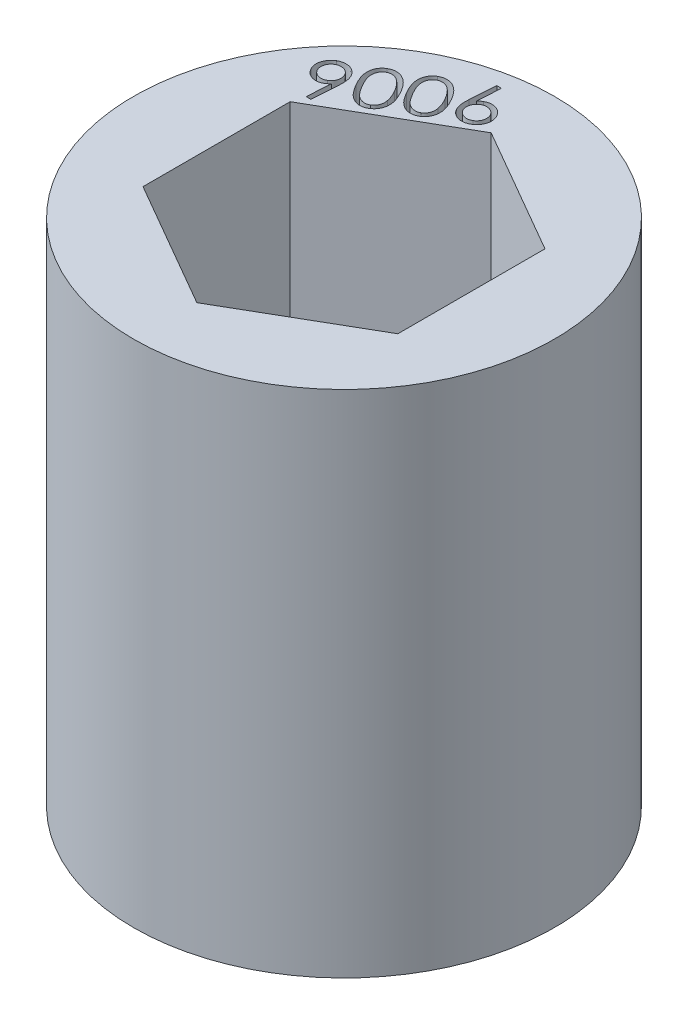
from build123d import *

# Parameters (mm, degrees)
SKETCH1_R           = 11.1125
BOSS_EXTRUDE1_DEPTH = 26.924
CUT_EXTRUDE1_DEPTH  = 2


with BuildPart() as part:
    # Sketch1 → Boss-Extrude1 (new body)
    with BuildSketch(Plane(origin=(0, 0, 0), x_dir=(1, 0, 0), z_dir=(0, 1, 0))):
        with Locations(Location((0, 0, 0), (0, 0, 270))):
            Circle(SKETCH1_R)
        Polygon((0, 7.772289324), (-6.731, 3.886144662), (-6.731, -3.886144662), (0, -7.772289324), (6.731, -3.886144662), (6.731, 3.886144662), align=None, mode=Mode.SUBTRACT)
    extrude(amount=BOSS_EXTRUDE1_DEPTH)

    # Sketch2 → Cut-Extrude1 (cut)
    # profile 1 of 4: a face of its own
    with BuildSketch(Plane(origin=(0, 26.924, 0), x_dir=(1, 0, 0), z_dir=(0, 1, 0))):
        with BuildLine():
            Line((-6.289733288, 4.536079133), (-6.537525756, 4.548290671))
            Line((-6.537525756, 4.548290671), (-6.464256525, 5.791323524))
            add(Edge.make_bspline(
                [(-6.464256525, 5.791323524), (-6.480242541, 5.773894572), (-6.511338885, 5.739991398), (-6.561839603, 5.69527463), (-6.612409982, 5.655457776), (-6.648221968, 5.633601591), (-6.66574691, 5.622906056)],
                knots=[0, 0, 0, 0, 1.07557127, 2.092224476, 3.066411598, 4, 4, 4, 4], degree=3))
            add(Edge.make_bspline(
                [(-6.66574691, 5.622906056), (-6.687405443, 5.611087473), (-6.730257805, 5.587703887), (-6.797554319, 5.560988642), (-6.865684027, 5.541202356), (-6.93486375, 5.529817864), (-7.004705016, 5.524358865), (-7.075685789, 5.527087617), (-7.147393014, 5.537446994), (-7.219246238, 5.554721004), (-7.289510388, 5.578337576), (-7.35650875, 5.608467922), (-7.419450569, 5.644728708), (-7.478082535, 5.687225822), (-7.532917297, 5.735292443), (-7.583437177, 5.789428113), (-7.629542025, 5.849943619), (-7.656438539, 5.893688865), (-7.670145948, 5.915982979)],
                knots=[0, 0, 0, 0, 1.015135184, 2.008489705, 2.974464217, 3.930823522, 4.890110555, 5.854468119, 6.84900024, 7.868689235, 8.893387844, 9.896732215, 10.888539014, 11.878968029, 12.873598221, 13.886496971, 14.922884625, 16, 16, 16, 16], degree=3))
            add(Edge.make_bspline(
                [(-7.670145948, 5.915982979), (-7.686989422, 5.947462864), (-7.72012857, 6.009398813), (-7.753683399, 6.108003656), (-7.77554064, 6.207694842), (-7.781550764, 6.308794459), (-7.775514984, 6.409686012), (-7.754046851, 6.508718862), (-7.719584706, 6.605382614), (-7.671907384, 6.698347933), (-7.612573873, 6.785344663), (-7.543839337, 6.864438697), (-7.464533964, 6.933174876), (-7.405410215, 6.970311538), (-7.375542583, 6.989071921)],
                knots=[0, 0, 0, 0, 1.035324533, 2.036977218, 3.013660684, 3.991039457, 4.968418229, 5.940283026, 6.923354643, 7.941094773, 8.965736768, 9.974485588, 10.976767849, 12, 12, 12, 12], degree=3))
            add(Edge.make_bspline(
                [(-7.375542583, 6.989071921), (-7.34507095, 7.005375839), (-7.284810938, 7.037618098), (-7.188138027, 7.070437121), (-7.088780159, 7.090561187), (-6.987526986, 7.097552892), (-6.886165863, 7.091769651), (-6.78725838, 7.071601586), (-6.691339738, 7.038343454), (-6.60068211, 6.990771666), (-6.515764574, 6.933108074), (-6.439404084, 6.865662075), (-6.372846225, 6.788703753), (-6.336853355, 6.731436227), (-6.318735692, 6.702609581)],
                knots=[0, 0, 0, 0, 1.019400264, 2.015942902, 3.002372847, 4.006779929, 5.005536382, 5.991966327, 6.979044859, 7.994053264, 9.007032045, 10.004279611, 10.995418019, 12, 12, 12, 12], degree=3))
            add(Edge.make_bspline(
                [(-6.318735692, 6.702609581), (-6.306240701, 6.679251996), (-6.280812696, 6.631718005), (-6.25054166, 6.554911705), (-6.226293373, 6.472609431), (-6.210571268, 6.400087646), (-6.201314114, 6.338420317), (-6.195489764, 6.288208021), (-6.192449763, 6.234523461), (-6.189498973, 6.177377331), (-6.1893075, 6.116958119), (-6.190314512, 6.053006011), (-6.19282965, 5.985653618), (-6.195674596, 5.939552777), (-6.197129121, 5.915982979)],
                knots=[0, 0, 0, 0, 1.179517641, 2.400384276, 3.669978525, 4.99951221, 5.702757638, 6.447991837, 7.250775919, 8.098000084, 8.997311831, 9.942054579, 10.947842213, 12, 12, 12, 12], degree=3))
            Line((-6.197129121, 5.915982979), (-6.289733288, 4.536079133))
        make_face()
        with BuildLine():
            add(Edge.make_bspline(
                [(-6.726295788, 5.844749004), (-6.71064732, 5.854271721), (-6.67991488, 5.872973636), (-6.638085098, 5.906050151), (-6.59996958, 5.941564352), (-6.566919829, 5.981135696), (-6.537714626, 6.023521997), (-6.512770228, 6.069073108), (-6.491586076, 6.117668987), (-6.475865153, 6.169141379), (-6.463817651, 6.221644628), (-6.458056762, 6.274374402), (-6.456118693, 6.326312762), (-6.460240047, 6.377704907), (-6.470203983, 6.428038328), (-6.484352589, 6.47793469), (-6.504337626, 6.526979386), (-6.521287063, 6.558422458), (-6.529893544, 6.574388428)],
                knots=[0, 0, 0, 0, 1.045108442, 2.052516081, 3.039037663, 4.014948609, 4.990090363, 5.974041511, 6.976128051, 8.011453109, 9.043011603, 10.047295345, 11.035574291, 12.007150616, 12.98344593, 13.961229243, 14.964765542, 16, 16, 16, 16], degree=3))
            add(Edge.make_bspline(
                [(-6.529893544, 6.574388428), (-6.539249183, 6.589862662), (-6.557739817, 6.620446186), (-6.590521987, 6.662080801), (-6.626381741, 6.699690397), (-6.665743743, 6.732780086), (-6.708181599, 6.761903737), (-6.753581699, 6.787026304), (-6.802439709, 6.807412214), (-6.853751361, 6.823401486), (-6.906330508, 6.835095), (-6.95895449, 6.841964713), (-7.010975356, 6.842867475), (-7.062261796, 6.838767193), (-7.11298991, 6.829718382), (-7.162946419, 6.81457088), (-7.212656065, 6.795071434), (-7.244107621, 6.777604573), (-7.260041781, 6.768755415)],
                knots=[0, 0, 0, 0, 1.031712043, 2.039092063, 3.018573684, 3.994457873, 4.969572892, 5.953497063, 6.951758218, 7.98705489, 9.018585102, 10.024008046, 11.012022604, 11.983572292, 12.958061913, 13.947831088, 14.960318852, 16, 16, 16, 16], degree=3))
            add(Edge.make_bspline(
                [(-7.260041781, 6.768755415), (-7.275548329, 6.759439004), (-7.306081237, 6.741094681), (-7.34725729, 6.707776179), (-7.385379905, 6.672479408), (-7.418356414, 6.632849856), (-7.447704876, 6.590638681), (-7.471928382, 6.544786242), (-7.493265763, 6.496366511), (-7.508934864, 6.444865827), (-7.520996677, 6.392370164), (-7.526733977, 6.339807253), (-7.528690189, 6.288040119), (-7.524568034, 6.236817067), (-7.514607962, 6.186483739), (-7.500458314, 6.136587351), (-7.48047356, 6.087542663), (-7.463524083, 6.05609959), (-7.454917583, 6.04013362)],
                knots=[0, 0, 0, 0, 1.034021631, 2.036022986, 3.024725885, 4.002794686, 4.980092595, 5.961574923, 6.965877195, 8.00349148, 9.037330872, 10.043835206, 11.024597356, 11.998321951, 12.97677597, 13.956721278, 14.962476515, 16, 16, 16, 16], degree=3))
            add(Edge.make_bspline(
                [(-7.454917583, 6.04013362), (-7.445562349, 6.024658768), (-7.427072518, 5.994074025), (-7.394284497, 5.95244831), (-7.358446249, 5.914806002), (-7.319111883, 5.881927029), (-7.277096804, 5.852416955), (-7.231595382, 5.827649353), (-7.183019633, 5.806434909), (-7.131541644, 5.790722408), (-7.079039897, 5.778672645), (-7.026309733, 5.772912344), (-6.974371474, 5.770974121), (-6.922979303, 5.775095516), (-6.872645889, 5.785059441), (-6.822749524, 5.79920805), (-6.77370483, 5.819193086), (-6.742261757, 5.836142524), (-6.726295788, 5.844749004)],
                knots=[0, 0, 0, 0, 1.033571637, 2.042767394, 3.024014467, 4.001657624, 4.970548117, 5.956245748, 6.96011096, 7.997273687, 9.030663166, 10.03672948, 11.026762591, 12.000063433, 12.97809164, 13.957610489, 14.962928033, 16, 16, 16, 16], degree=3))
        make_face(mode=Mode.SUBTRACT)
    # profile 2 of 4: a face of its own
    with BuildSketch(Plane(origin=(0, 26.924, 0), x_dir=(1, 0, 0), z_dir=(0, 1, 0))):
        with BuildLine():
            add(Edge.make_bspline(
                [(-5.754187339, 6.384091953), (-5.774293485, 6.419396325), (-5.813397002, 6.488058169), (-5.866034024, 6.590465673), (-5.91315215, 6.687996963), (-5.953449969, 6.781164397), (-5.987295398, 6.86972097), (-6.014264868, 6.953849745), (-6.035638255, 7.033380296), (-6.049888486, 7.109113956), (-6.058619809, 7.181548399), (-6.062601698, 7.251221126), (-6.062856211, 7.318691765), (-6.058271229, 7.383994619), (-6.049205939, 7.447116612), (-6.035432829, 7.50803618), (-6.016976099, 7.566647617), (-5.994620362, 7.623140357), (-5.968452651, 7.677139167), (-5.937349294, 7.727501238), (-5.904178107, 7.775608715), (-5.866621008, 7.819808262), (-5.826373044, 7.861568139), (-5.781909405, 7.899391142), (-5.73455379, 7.934984377), (-5.700608239, 7.955588006), (-5.683462178, 7.965994998)],
                knots=[0, 0, 0, 0, 1.642217524, 3.193873097, 4.653599743, 6.020219012, 7.296149585, 8.484364078, 9.590266645, 10.622995624, 11.596731579, 12.537641419, 13.442669779, 14.322439731, 15.181528583, 16.018162769, 16.844365298, 17.663022962, 18.472528165, 19.266229043, 20.053716379, 20.832379209, 21.608138827, 22.395685855, 23.18965321, 24, 24, 24, 24], degree=3))
            add(Edge.make_bspline(
                [(-5.683462178, 7.965994998), (-5.66563454, 7.975796724), (-5.630291488, 7.995228513), (-5.574947636, 8.018860372), (-5.51920601, 8.039024632), (-5.462120844, 8.053805918), (-5.404262578, 8.063929555), (-5.345231728, 8.06958247), (-5.285348145, 8.070558879), (-5.224644164, 8.066897508), (-5.163312434, 8.058955872), (-5.101899155, 8.04511862), (-5.040677301, 8.025933176), (-4.979105772, 8.002804322), (-4.918424308, 7.972905924), (-4.857473214, 7.938551421), (-4.796343719, 7.899560349), (-4.735768702, 7.85435269), (-4.674503653, 7.803725452), (-4.613882954, 7.745708582), (-4.552994497, 7.680722999), (-4.492751705, 7.608524687), (-4.432696679, 7.529143413), (-4.371922586, 7.443276561), (-4.312209796, 7.349568109), (-4.273517599, 7.284128721), (-4.25369455, 7.25060237)],
                knots=[0, 0, 0, 0, 0.815881076, 1.617473213, 2.411751612, 3.192532544, 3.980223438, 4.766442947, 5.569622482, 6.380892254, 7.204795063, 8.048528362, 8.903143009, 9.777765604, 10.684831081, 11.614241792, 12.584586996, 13.591843045, 14.645331516, 15.771781295, 16.956234458, 18.217113798, 19.542884518, 20.949560407, 22.437178076, 24, 24, 24, 24], degree=3))
            add(Edge.make_bspline(
                [(-4.25369455, 7.25060237), (-4.234690702, 7.216780141), (-4.197627599, 7.150816829), (-4.146394818, 7.052709669), (-4.102388393, 6.957606704), (-4.06375745, 6.866288593), (-4.031813147, 6.778445302), (-4.005466056, 6.694139945), (-3.985556454, 6.61326208), (-3.971553551, 6.535580237), (-3.963763238, 6.460736031), (-3.959131325, 6.388727981), (-3.960560527, 6.319048982), (-3.965139736, 6.251653327), (-3.975651576, 6.18660532), (-3.989666869, 6.12376281), (-4.00853456, 6.063498422), (-4.03210177, 6.005932814), (-4.059343758, 5.951068478), (-4.090834897, 5.899529072), (-4.124644903, 5.8505242), (-4.162412934, 5.804855912), (-4.204607514, 5.763339639), (-4.249147626, 5.724032156), (-4.29735414, 5.687907222), (-4.331863462, 5.667054984), (-4.349351601, 5.656487787)],
                knots=[0, 0, 0, 0, 1.558572261, 3.039675171, 4.44500239, 5.767404933, 7.021920233, 8.19867626, 9.314183841, 10.366093107, 11.366862767, 12.335955634, 13.262731656, 14.164729598, 15.047477431, 15.907015182, 16.749641984, 17.580952634, 18.403702246, 19.207672054, 20.005351578, 20.794016824, 21.584181799, 22.380929523, 23.179510693, 24, 24, 24, 24], degree=3))
            add(Edge.make_bspline(
                [(-4.349351601, 5.656487787), (-4.366867865, 5.64692339), (-4.401647998, 5.627932412), (-4.455584616, 5.603818321), (-4.510920625, 5.585238922), (-4.566725332, 5.570088564), (-4.623682967, 5.560729828), (-4.681299048, 5.554891765), (-4.739996656, 5.554035612), (-4.799414032, 5.557375365), (-4.85905512, 5.566369161), (-4.918799441, 5.57920757), (-4.977922207, 5.59860306), (-5.037209801, 5.62190041), (-5.096304517, 5.650629538), (-5.155360864, 5.684164046), (-5.213955415, 5.723209146), (-5.272992568, 5.767022214), (-5.331645932, 5.817869105), (-5.390967307, 5.875768126), (-5.450819129, 5.941295459), (-5.510755803, 6.014932478), (-5.571475243, 6.095992393), (-5.632081705, 6.18508862), (-5.694078792, 6.281394124), (-5.73374727, 6.349169287), (-5.754187339, 6.384091953)],
                knots=[0, 0, 0, 0, 0.807491903, 1.603348545, 2.386916451, 3.167713854, 3.940658363, 4.719915701, 5.50935356, 6.313835313, 7.125313705, 7.947948844, 8.783651521, 9.640150085, 10.524255013, 11.440287308, 12.386399569, 13.372019105, 14.413529699, 15.525036669, 16.724996316, 18.002813491, 19.365932914, 20.822335035, 22.362637201, 24, 24, 24, 24], degree=3))
        make_face()
        with BuildLine():
            add(Edge.make_bspline(
                [(-5.544047114, 6.499592754), (-5.52658648, 6.469635353), (-5.492775062, 6.411624732), (-5.440722732, 6.329066845), (-5.389839812, 6.253328925), (-5.340729323, 6.183943981), (-5.292471574, 6.121691943), (-5.245019097, 6.066724801), (-5.19931687, 6.018007096), (-5.154224806, 5.975903967), (-5.109396023, 5.939358119), (-5.064587362, 5.907144081), (-5.019309127, 5.879194874), (-4.973966892, 5.855112011), (-4.928194317, 5.83512142), (-4.882233088, 5.818639915), (-4.835611692, 5.807159403), (-4.77455364, 5.796223916), (-4.699575679, 5.792036903), (-4.612937682, 5.800692291), (-4.530948212, 5.822078626), (-4.48143415, 5.847380164), (-4.456711377, 5.860013428)],
                knots=[0, 0, 0, 0, 1.475228016, 2.856686104, 4.15161897, 5.357081144, 6.47289893, 7.501387829, 8.445726694, 9.313720896, 10.124066195, 10.905058304, 11.660046733, 12.386348828, 13.08755313, 13.783651734, 14.460982071, 15.127735434, 16.421461315, 17.639985157, 18.821625413, 20, 20, 20, 20], degree=3))
            add(Edge.make_bspline(
                [(-4.456711377, 5.860013428), (-4.433210095, 5.875167649), (-4.386473482, 5.9053046), (-4.326638516, 5.965035038), (-4.276632416, 6.034934937), (-4.243199965, 6.100713561), (-4.222574331, 6.157822271), (-4.209542229, 6.203111769), (-4.201188418, 6.250698833), (-4.195874372, 6.300006821), (-4.195320308, 6.351206826), (-4.197055498, 6.404249124), (-4.203301327, 6.459144995), (-4.210059059, 6.496066769), (-4.213498236, 6.514857178)],
                knots=[0, 0, 0, 0, 1.342886321, 2.670576022, 4.038999414, 5.466462105, 6.205051725, 6.959707281, 7.731476591, 8.527516338, 9.344012544, 10.193626534, 11.080691652, 12, 12, 12, 12], degree=3))
            add(Edge.make_bspline(
                [(-4.213498236, 6.514857178), (-4.218301514, 6.538668619), (-4.228077303, 6.587130449), (-4.248401628, 6.659833425), (-4.272291032, 6.734422811), (-4.300675086, 6.810310901), (-4.333671229, 6.887532526), (-4.370173502, 6.96642732), (-4.411392775, 7.046902943), (-4.441751638, 7.100275027), (-4.457220191, 7.127469357)],
                knots=[0, 0, 0, 0, 0.879876913, 1.790754508, 2.73331625, 3.717259664, 4.725112015, 5.77538776, 6.866507818, 8, 8, 8, 8], degree=3))
            add(Edge.make_bspline(
                [(-4.457220191, 7.127469357), (-4.472953671, 7.154395208), (-4.503737596, 7.207077984), (-4.552331457, 7.282057596), (-4.599972981, 7.352681972), (-4.648293775, 7.417929235), (-4.697195744, 7.477724842), (-4.74544551, 7.533155772), (-4.794324147, 7.582970878), (-4.843281593, 7.627936761), (-4.892124645, 7.668061204), (-4.940291843, 7.703932752), (-4.988581279, 7.734565983), (-5.036316348, 7.761295466), (-5.084043059, 7.783023825), (-5.1312272, 7.800691115), (-5.178230646, 7.813537496), (-5.23948708, 7.823980223), (-5.314019222, 7.828278585), (-5.400084024, 7.820429936), (-5.481280875, 7.79884349), (-5.530335434, 7.773871359), (-5.55473221, 7.761451729)],
                knots=[0, 0, 0, 0, 1.327522451, 2.597413504, 3.803087542, 4.954092809, 6.052504639, 7.091116491, 8.08170511, 9.022070092, 9.919800897, 10.771882377, 11.577119672, 12.352806521, 13.099205072, 13.807429758, 14.495830891, 15.170113202, 16.450227669, 17.661618134, 18.837030004, 20, 20, 20, 20], degree=3))
            add(Edge.make_bspline(
                [(-5.55473221, 7.761451729), (-5.578268129, 7.746329038), (-5.625174133, 7.716190211), (-5.6847186, 7.655701744), (-5.735752136, 7.585407529), (-5.768763344, 7.518362712), (-5.790724395, 7.460792436), (-5.802511098, 7.414776676), (-5.811895219, 7.367255497), (-5.81760498, 7.317740822), (-5.818656653, 7.266377086), (-5.817555344, 7.213317018), (-5.811372707, 7.158684881), (-5.803026021, 7.101656467), (-5.789498074, 7.041447844), (-5.770476408, 6.977263975), (-5.74575291, 6.908653392), (-5.716252643, 6.835242841), (-5.681006683, 6.75763465), (-5.640521598, 6.675395672), (-5.594987317, 6.588537417), (-5.561372529, 6.529843972), (-5.544047114, 6.499592754)],
                knots=[0, 0, 0, 0, 1.186584607, 2.364808541, 3.584028067, 4.867913378, 5.52979883, 6.201670858, 6.884946004, 7.589109066, 8.317961587, 9.068444384, 9.84432244, 10.65432116, 11.518850237, 12.466086659, 13.499587148, 14.619373863, 15.830028341, 17.123623296, 18.517485242, 20, 20, 20, 20], degree=3))
        make_face(mode=Mode.SUBTRACT)
    # profile 3 of 4: a face of its own
    with BuildSketch(Plane(origin=(0, 26.924, 0), x_dir=(1, 0, 0), z_dir=(0, 1, 0))):
        with BuildLine():
            add(Edge.make_bspline(
                [(-4.062106934, 7.36101503), (-4.082213081, 7.396319402), (-4.121316598, 7.464981246), (-4.173953619, 7.567388749), (-4.221071746, 7.66492004), (-4.261369564, 7.758087474), (-4.295214994, 7.846644047), (-4.322184464, 7.930772822), (-4.343557851, 8.010303373), (-4.357808082, 8.086037033), (-4.366539405, 8.158471476), (-4.370521294, 8.228144203), (-4.370775807, 8.295614841), (-4.366190825, 8.360917696), (-4.357125534, 8.424039689), (-4.343352425, 8.484959257), (-4.324895695, 8.543570694), (-4.302539958, 8.600063434), (-4.276372246, 8.654062244), (-4.24526889, 8.704424315), (-4.212097703, 8.752531792), (-4.174540604, 8.796731339), (-4.13429264, 8.838491216), (-4.089829, 8.876314219), (-4.042473386, 8.911907454), (-4.008527835, 8.932511083), (-3.991381774, 8.942918075)],
                knots=[0, 0, 0, 0, 1.642217524, 3.193873097, 4.653599743, 6.020219012, 7.296149585, 8.484364078, 9.590266645, 10.622995624, 11.596731579, 12.537641419, 13.442669779, 14.322439731, 15.181528583, 16.018162769, 16.844365298, 17.663022962, 18.472528165, 19.266229043, 20.053716379, 20.832379209, 21.608138827, 22.395685855, 23.18965321, 24, 24, 24, 24], degree=3))
            add(Edge.make_bspline(
                [(-3.991381774, 8.942918075), (-3.973554136, 8.952719801), (-3.938211083, 8.97215159), (-3.882867231, 8.995783449), (-3.827125606, 9.015947709), (-3.77004044, 9.030728995), (-3.712182174, 9.040852632), (-3.653151324, 9.046505547), (-3.59326774, 9.047481956), (-3.53256376, 9.043820585), (-3.471232029, 9.035878949), (-3.409818751, 9.022041697), (-3.348596897, 9.002856253), (-3.287025367, 8.979727399), (-3.226343903, 8.949829001), (-3.165392809, 8.915474498), (-3.104263315, 8.876483426), (-3.043688298, 8.831275767), (-2.982423249, 8.780648529), (-2.92180255, 8.722631659), (-2.860914092, 8.657646076), (-2.800671301, 8.585447764), (-2.740616275, 8.50606649), (-2.679842182, 8.420199638), (-2.620129391, 8.326491186), (-2.581437195, 8.261051798), (-2.561614146, 8.227525447)],
                knots=[0, 0, 0, 0, 0.815881076, 1.617473213, 2.411751612, 3.192532544, 3.980223438, 4.766442947, 5.569622482, 6.380892254, 7.204795063, 8.048528362, 8.903143009, 9.777765604, 10.684831081, 11.614241792, 12.584586996, 13.591843045, 14.645331516, 15.771781295, 16.956234458, 18.217113798, 19.542884518, 20.949560407, 22.437178076, 24, 24, 24, 24], degree=3))
            add(Edge.make_bspline(
                [(-2.561614146, 8.227525447), (-2.542610298, 8.193703218), (-2.505547195, 8.127739906), (-2.454314413, 8.029632746), (-2.410307988, 7.934529781), (-2.371677046, 7.84321167), (-2.339732743, 7.755368379), (-2.313385652, 7.671063022), (-2.29347605, 7.590185156), (-2.279473146, 7.512503314), (-2.271682834, 7.437659107), (-2.26705092, 7.365651058), (-2.268480123, 7.295972059), (-2.273059332, 7.228576404), (-2.283571172, 7.163528397), (-2.297586465, 7.100685887), (-2.316454156, 7.040421499), (-2.340021365, 6.982855891), (-2.367263353, 6.927991555), (-2.398754493, 6.876452149), (-2.432564499, 6.827447277), (-2.470332529, 6.781778989), (-2.512527109, 6.740262716), (-2.557067222, 6.700955233), (-2.605273736, 6.664830299), (-2.639783058, 6.643978061), (-2.657271197, 6.633410863)],
                knots=[0, 0, 0, 0, 1.558572261, 3.039675171, 4.44500239, 5.767404933, 7.021920233, 8.19867626, 9.314183841, 10.366093107, 11.366862767, 12.335955634, 13.262731656, 14.164729598, 15.047477431, 15.907015182, 16.749641984, 17.580952634, 18.403702246, 19.207672054, 20.005351578, 20.794016824, 21.584181799, 22.380929523, 23.179510693, 24, 24, 24, 24], degree=3))
            add(Edge.make_bspline(
                [(-2.657271197, 6.633410863), (-2.674787461, 6.623846467), (-2.709567594, 6.604855489), (-2.763504212, 6.580741398), (-2.818840221, 6.562161998), (-2.874644928, 6.547011641), (-2.931602563, 6.537652905), (-2.989218644, 6.531814842), (-3.047916251, 6.530958688), (-3.107333628, 6.534298442), (-3.166974716, 6.543292238), (-3.226719037, 6.556130647), (-3.285841803, 6.575526137), (-3.345129397, 6.598823487), (-3.404224112, 6.627552615), (-3.46328046, 6.661087123), (-3.521875011, 6.700132223), (-3.580912164, 6.743945291), (-3.639565528, 6.794792182), (-3.698886903, 6.852691203), (-3.758738725, 6.918218536), (-3.818675399, 6.991855554), (-3.879394839, 7.07291547), (-3.940001301, 7.162011697), (-4.001998388, 7.258317201), (-4.041666866, 7.326092364), (-4.062106934, 7.36101503)],
                knots=[0, 0, 0, 0, 0.807491903, 1.603348545, 2.386916451, 3.167713854, 3.940658363, 4.719915701, 5.50935356, 6.313835313, 7.125313705, 7.947948844, 8.783651521, 9.640150085, 10.524255013, 11.440287308, 12.386399569, 13.372019105, 14.413529699, 15.525036669, 16.724996316, 18.002813491, 19.365932914, 20.822335035, 22.362637201, 24, 24, 24, 24], degree=3))
        make_face()
        with BuildLine():
            add(Edge.make_bspline(
                [(-3.85196671, 7.476515831), (-3.834506076, 7.44655843), (-3.800694658, 7.388547809), (-3.748642328, 7.305989922), (-3.697759407, 7.230252002), (-3.648648919, 7.160867058), (-3.600391169, 7.09861502), (-3.552938693, 7.043647878), (-3.507236466, 6.994930173), (-3.462144402, 6.952827044), (-3.417315618, 6.916281196), (-3.372506958, 6.884067158), (-3.327228723, 6.856117951), (-3.281886487, 6.832035088), (-3.236113913, 6.812044497), (-3.190152683, 6.795562992), (-3.143531287, 6.78408248), (-3.082473236, 6.773146992), (-3.007495274, 6.76895998), (-2.920857278, 6.777615368), (-2.838867807, 6.799001703), (-2.789353746, 6.824303241), (-2.764630973, 6.836936504)],
                knots=[0, 0, 0, 0, 1.475228016, 2.856686104, 4.15161897, 5.357081144, 6.47289893, 7.501387829, 8.445726694, 9.313720896, 10.124066195, 10.905058304, 11.660046733, 12.386348828, 13.08755313, 13.783651734, 14.460982071, 15.127735434, 16.421461315, 17.639985157, 18.821625413, 20, 20, 20, 20], degree=3))
            add(Edge.make_bspline(
                [(-2.764630973, 6.836936504), (-2.741129691, 6.852090725), (-2.694393077, 6.882227676), (-2.634558111, 6.941958115), (-2.584552012, 7.011858014), (-2.551119561, 7.077636638), (-2.530493927, 7.134745348), (-2.517461825, 7.180034846), (-2.509108014, 7.22762191), (-2.503793967, 7.276929898), (-2.503239904, 7.328129903), (-2.504975094, 7.381172201), (-2.511220923, 7.436068071), (-2.517978654, 7.472989846), (-2.521417832, 7.491780254)],
                knots=[0, 0, 0, 0, 1.342886321, 2.670576022, 4.038999414, 5.466462105, 6.205051725, 6.959707281, 7.731476591, 8.527516338, 9.344012544, 10.193626534, 11.080691652, 12, 12, 12, 12], degree=3))
            add(Edge.make_bspline(
                [(-2.521417832, 7.491780254), (-2.52622111, 7.515591696), (-2.535996899, 7.564053526), (-2.556321224, 7.636756502), (-2.580210628, 7.711345888), (-2.608594682, 7.787233978), (-2.641590825, 7.864455603), (-2.678093098, 7.943350397), (-2.719312371, 8.02382602), (-2.749671233, 8.077198104), (-2.765139787, 8.104392434)],
                knots=[0, 0, 0, 0, 0.879876913, 1.790754508, 2.73331625, 3.717259664, 4.725112015, 5.77538776, 6.866507818, 8, 8, 8, 8], degree=3))
            add(Edge.make_bspline(
                [(-2.765139787, 8.104392434), (-2.780873266, 8.131318285), (-2.811657192, 8.184001061), (-2.860251052, 8.258980673), (-2.907892577, 8.329605049), (-2.956213371, 8.394852312), (-3.00511534, 8.454647919), (-3.053365106, 8.510078849), (-3.102243743, 8.559893955), (-3.151201188, 8.604859838), (-3.20004424, 8.644984281), (-3.248211439, 8.680855829), (-3.296500875, 8.71148906), (-3.344235944, 8.738218543), (-3.391962655, 8.759946901), (-3.439146796, 8.777614192), (-3.486150242, 8.790460573), (-3.547406675, 8.8009033), (-3.621938818, 8.805201662), (-3.70800362, 8.797353012), (-3.78920047, 8.775766567), (-3.838255029, 8.750794436), (-3.862651806, 8.738374806)],
                knots=[0, 0, 0, 0, 1.327522451, 2.597413504, 3.803087542, 4.954092809, 6.052504639, 7.091116491, 8.08170511, 9.022070092, 9.919800897, 10.771882377, 11.577119672, 12.352806521, 13.099205072, 13.807429758, 14.495830891, 15.170113202, 16.450227669, 17.661618134, 18.837030004, 20, 20, 20, 20], degree=3))
            add(Edge.make_bspline(
                [(-3.862651806, 8.738374806), (-3.886187725, 8.723252115), (-3.933093729, 8.693113288), (-3.992638195, 8.632624821), (-4.043671731, 8.562330606), (-4.07668294, 8.495285789), (-4.09864399, 8.437715513), (-4.110430694, 8.391699753), (-4.119814814, 8.344178574), (-4.125524575, 8.294663899), (-4.126576249, 8.243300163), (-4.12547494, 8.190240095), (-4.119292303, 8.135607958), (-4.110945616, 8.078579544), (-4.09741767, 8.018370921), (-4.078396003, 7.954187052), (-4.053672506, 7.885576469), (-4.024172238, 7.812165918), (-3.988926279, 7.734557727), (-3.948441194, 7.652318749), (-3.902906913, 7.565460494), (-3.869292125, 7.506767049), (-3.85196671, 7.476515831)],
                knots=[0, 0, 0, 0, 1.186584607, 2.364808541, 3.584028067, 4.867913378, 5.52979883, 6.201670858, 6.884946004, 7.589109066, 8.317961587, 9.068444384, 9.84432244, 10.65432116, 11.518850237, 12.466086659, 13.499587148, 14.619373863, 15.830028341, 17.123623296, 18.517485242, 20, 20, 20, 20], degree=3))
        make_face(mode=Mode.SUBTRACT)
    # profile 4 of 4: a face of its own
    with BuildSketch(Plane(origin=(0, 26.924, 0), x_dir=(1, 0, 0), z_dir=(0, 1, 0))):
        with BuildLine():
            Line((-2.012330216, 10.085714549), (-1.763011306, 10.072485383))
            Line((-1.763011306, 10.072485383), (-1.836789351, 8.82945253))
            add(Edge.make_bspline(
                [(-1.836789351, 8.82945253), (-1.820777675, 8.847020594), (-1.789717729, 8.881099669), (-1.739683731, 8.926641251), (-1.689275845, 8.966850991), (-1.653346623, 8.988720731), (-1.63580778, 8.99939644)],
                knots=[0, 0, 0, 0, 1.078534366, 2.09217443, 3.068695275, 4, 4, 4, 4], degree=3))
            add(Edge.make_bspline(
                [(-1.63580778, 8.99939644), (-1.614148396, 9.011209416), (-1.571294351, 9.03458191), (-1.504010138, 9.061378236), (-1.435807281, 9.080874946), (-1.366775718, 9.093354428), (-1.296816771, 9.09770843), (-1.225874089, 9.095281508), (-1.15416291, 9.084831327), (-1.082297806, 9.067609538), (-1.011938634, 9.043828179), (-0.944615352, 9.014014307), (-0.881789392, 8.977467304), (-0.822651822, 8.935654386), (-0.768276529, 8.887145064), (-0.71818115, 8.832551085), (-0.67138899, 8.772679277), (-0.644872362, 8.728666618), (-0.631408742, 8.706319517)],
                knots=[0, 0, 0, 0, 1.014919989, 2.008063932, 2.973833671, 3.931187618, 4.889788302, 5.853941435, 6.848262729, 7.867735563, 8.89221695, 9.901718856, 10.893315405, 11.879464596, 12.878505815, 13.886437075, 14.926854091, 16, 16, 16, 16], degree=3))
            add(Edge.make_bspline(
                [(-0.631408742, 8.706319517), (-0.614358597, 8.674858847), (-0.580848, 8.613025597), (-0.547304945, 8.514134822), (-0.5255103, 8.414092406), (-0.519502861, 8.312664468), (-0.525494644, 8.211583409), (-0.547160363, 8.112466513), (-0.581066915, 8.015452443), (-0.630015885, 7.923077796), (-0.688506154, 7.83572229), (-0.758985856, 7.75790987), (-0.837644589, 7.687978265), (-0.897428526, 7.650891566), (-0.927538549, 7.632212947)],
                knots=[0, 0, 0, 0, 1.035410961, 2.035011424, 3.014503681, 3.994785016, 4.970161299, 5.940034904, 6.92572405, 7.93925945, 8.961802121, 9.964383429, 10.974767044, 12, 12, 12, 12], degree=3))
            add(Edge.make_bspline(
                [(-0.927538549, 7.632212947), (-0.957856061, 7.616110389), (-1.017866214, 7.58423716), (-1.114121267, 7.55136712), (-1.213078699, 7.530792924), (-1.314011227, 7.523061414), (-1.415042169, 7.529098319), (-1.513809678, 7.549118884), (-1.609547111, 7.582573736), (-1.700642974, 7.629342962), (-1.785316585, 7.687706899), (-1.861471392, 7.755769916), (-1.929029197, 7.832661164), (-1.965100934, 7.890478226), (-1.983327812, 7.919692915)],
                knots=[0, 0, 0, 0, 1.012834805, 2.004794247, 2.992378243, 3.992303334, 4.986209655, 5.972789007, 6.960017044, 7.972889029, 8.988854591, 9.989582794, 10.984145643, 12, 12, 12, 12], degree=3))
            add(Edge.make_bspline(
                [(-1.983327812, 7.919692915), (-1.995871121, 7.942860554), (-2.021366918, 7.989951591), (-2.050917305, 8.066639901), (-2.075425672, 8.148433048), (-2.090307695, 8.220915919), (-2.100005616, 8.282478349), (-2.104571394, 8.332809314), (-2.10905554, 8.386373454), (-2.110758011, 8.443420142), (-2.111306653, 8.503983174), (-2.110217548, 8.567941435), (-2.107697126, 8.63529106), (-2.104862517, 8.681223093), (-2.10340794, 8.704793075)],
                knots=[0, 0, 0, 0, 1.175348489, 2.389038421, 3.661399288, 4.984846163, 5.689624058, 6.443210121, 7.240726333, 8.089492672, 8.990764142, 9.945138093, 10.945549418, 12, 12, 12, 12], degree=3))
            Line((-2.10340794, 8.704793075), (-2.012330216, 10.085714549))
        make_face()
        with BuildLine():
            add(Edge.make_bspline(
                [(-1.576785344, 8.776535863), (-1.592259652, 8.767180255), (-1.622843319, 8.748689682), (-1.664476887, 8.715907072), (-1.70209033, 8.680048934), (-1.735165777, 8.640680948), (-1.764342679, 8.598265467), (-1.78929582, 8.552722315), (-1.810473455, 8.504124069), (-1.826212048, 8.452653009), (-1.838195988, 8.400146904), (-1.844185585, 8.347431042), (-1.845295214, 8.295292224), (-1.841190638, 8.243823359), (-1.832116175, 8.192931295), (-1.816967555, 8.142974007), (-1.797468414, 8.093264572), (-1.78000151, 8.061812988), (-1.771152331, 8.045878812)],
                knots=[0, 0, 0, 0, 1.030920477, 2.037527599, 3.016257727, 3.991393183, 4.96576006, 5.948929329, 6.95021958, 7.984721936, 9.015460722, 10.018946429, 11.006202947, 11.986653837, 12.960395796, 13.949405585, 14.961116532, 16, 16, 16, 16], degree=3))
            add(Edge.make_bspline(
                [(-1.771152331, 8.045878812), (-1.761836296, 8.03037172), (-1.743492714, 7.999837738), (-1.710168814, 7.958669508), (-1.674892088, 7.920517846), (-1.635296308, 7.887737611), (-1.593484143, 7.858058426), (-1.547674497, 7.834017605), (-1.499277145, 7.812647728), (-1.447770228, 7.796987568), (-1.395276248, 7.784923754), (-1.342544064, 7.779167105), (-1.290606331, 7.777227931), (-1.239214022, 7.781349575), (-1.188880645, 7.791313433), (-1.138984271, 7.80546206), (-1.089939579, 7.825447092), (-1.058496506, 7.84239653), (-1.042530536, 7.851003011)],
                knots=[0, 0, 0, 0, 1.033910717, 2.035804593, 3.02440144, 4.002365328, 4.971573682, 5.952950731, 6.957145278, 7.994648264, 9.028376762, 10.034773133, 11.02513104, 11.998751189, 12.977100254, 13.95694045, 14.962587805, 16, 16, 16, 16], degree=3))
            add(Edge.make_bspline(
                [(-1.042530536, 7.851003011), (-1.027055758, 7.860358275), (-0.996471159, 7.878848167), (-0.954844389, 7.911635748), (-0.917205958, 7.947475612), (-0.884312674, 7.986804012), (-0.854855831, 8.02884128), (-0.829917465, 8.074199724), (-0.809501009, 8.123035353), (-0.79351427, 8.174353881), (-0.781842281, 8.226928805), (-0.774886633, 8.279562475), (-0.774298035, 8.331536938), (-0.777247288, 8.382964937), (-0.787522889, 8.433271699), (-0.801586709, 8.483171894), (-0.821594787, 8.532215548), (-0.838541051, 8.563658763), (-0.847145921, 8.579624806)],
                knots=[0, 0, 0, 0, 1.033804194, 2.043227023, 3.02469488, 4.00255801, 4.971666507, 5.957585922, 6.957871394, 7.995267487, 9.028889481, 10.036351266, 11.026369363, 11.999163434, 12.977411701, 13.957150944, 14.962694688, 16, 16, 16, 16], degree=3))
            add(Edge.make_bspline(
                [(-0.847145921, 8.579624806), (-0.85667898, 8.59526305), (-0.875401207, 8.625975411), (-0.908402986, 8.668042891), (-0.944463365, 8.705602563), (-0.983542973, 8.739175206), (-1.026031055, 8.76832957), (-1.071879493, 8.793020896), (-1.120565838, 8.81433719), (-1.172043601, 8.830119949), (-1.224592921, 8.841851319), (-1.277064471, 8.848771867), (-1.328866647, 8.849382698), (-1.380125606, 8.846432165), (-1.430432202, 8.836159522), (-1.480332442, 8.822094904), (-1.529376084, 8.802087043), (-1.560819301, 8.785140748), (-1.576785344, 8.776535863)],
                knots=[0, 0, 0, 0, 1.045218378, 2.052731988, 3.046038375, 4.014670804, 4.989915135, 5.982465653, 6.984657604, 8.020091569, 9.051758574, 10.05731485, 11.03577647, 12.006730602, 12.983128614, 13.961014782, 14.964656644, 16, 16, 16, 16], degree=3))
        make_face(mode=Mode.SUBTRACT)
    extrude(amount=-CUT_EXTRUDE1_DEPTH, mode=Mode.SUBTRACT)


solid = part.part
